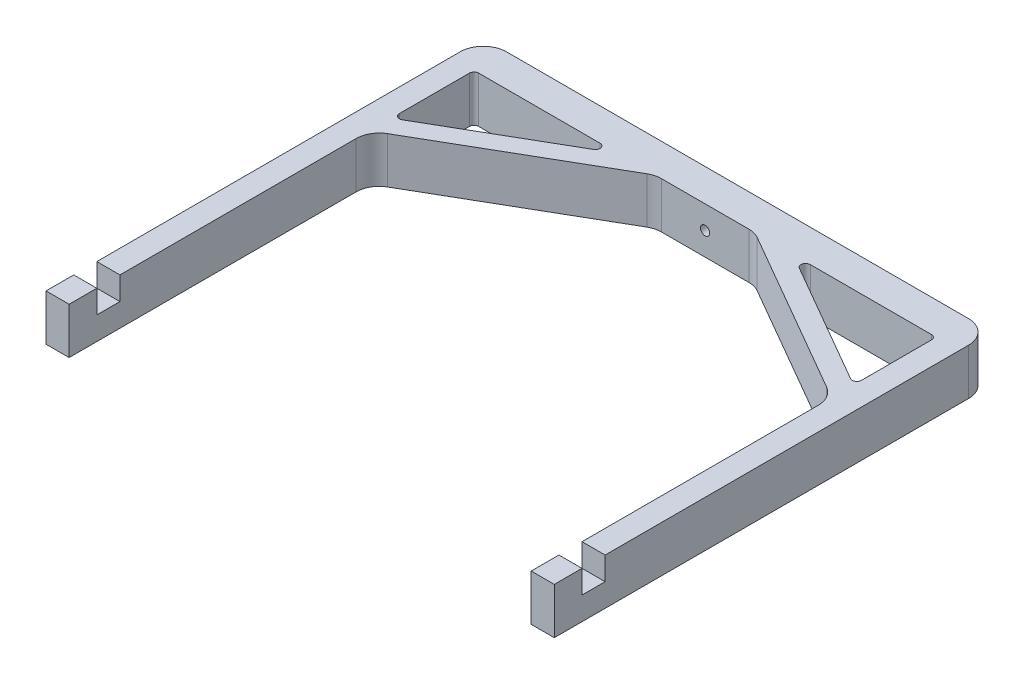
from build123d import *

# Parameters (mm, degrees)
DODANIE_WYCI_GNI_CIE1_DEPTH   = 10
SZKIC1_W                      = 5
SZKIC1_H                      = 6
DODANIE_WYCI_GNI_CIE1_2_DEPTH = 10
DODANIE_WYCI_GNI_CIE1_3_DEPTH = 10
SZKIC1_3_W                    = 5
SZKIC1_3_H                    = 5
DODANIE_WYCI_GNI_CIE2_DEPTH   = 5
SZKIC2_R                      = 1
WYTNIJ_WYCI_GNI_CIE1_DEPTH    = 104.949507791


with BuildPart() as part:
    # Szkic1 → Dodanie-wyciągnięcie1 (new body)
    with BuildSketch(Plane(origin=(0, 0, 0), x_dir=(1, 0, 0), z_dir=(0, 1, 0))):
        with BuildLine():
            Line((-9.449286184, 87.638462845), (9.449286184, 87.638462845))
            ThreePointArc((9.449286184, 87.638462845), (10.74338141, 87.468091977), (11.949286184, 86.968589864))
            Line((11.949286184, 86.968589864), (47.5, 66.443375673))
            ThreePointArc((47.5, 66.443375673), (49.330127019, 64.613248654), (50, 62.113248654))
            Line((50, 62.113248654), (50, 11))
            Line((50, 11), (55, 11))
            Line((55, 11), (55, 89.638462845))
            ThreePointArc((55, 89.638462845), (53.535533906, 93.173996751), (50, 94.638462845))
            Line((50, 94.638462845), (-50, 94.638462845))
            ThreePointArc((-50, 94.638462845), (-53.535533906, 93.173996751), (-55, 89.638462845))
            Line((-55, 89.638462845), (-55, 11))
            Line((-55, 11), (-50, 11))
            Line((-50, 11), (-50, 62.113248654))
            ThreePointArc((-50, 62.113248654), (-49.330127019, 64.613248654), (-47.5, 66.443375673))
            Line((-47.5, 66.443375673), (-11.949286184, 86.968589864))
            ThreePointArc((-11.949286184, 86.968589864), (-10.74338141, 87.468091977), (-9.449286184, 87.638462845))
        make_face()
        with BuildLine():
            ThreePointArc((-48.5, 70.620674679), (-49.5, 70.620674679), (-50, 71.486700083))
            Line((-50, 71.486700083), (-50, 86.638462845))
            ThreePointArc((-50, 86.638462845), (-49.707106781, 87.345569627), (-49, 87.638462845))
            Line((-49, 87.638462845), (-22.756377072, 87.638462845))
            ThreePointArc((-22.756377072, 87.638462845), (-21.790451246, 86.89728189), (-22.256377072, 85.772437442))
            Line((-22.256377072, 85.772437442), (-48.5, 70.620674679))
        make_face(mode=Mode.SUBTRACT)
        with BuildLine():
            Line((48.5, 70.620674679), (22.256377072, 85.772437442))
            ThreePointArc((22.256377072, 85.772437442), (21.790451246, 86.89728189), (22.756377072, 87.638462845))
            Line((22.756377072, 87.638462845), (49, 87.638462845))
            ThreePointArc((49, 87.638462845), (49.707106781, 87.345569627), (50, 86.638462845))
            Line((50, 86.638462845), (50, 71.486700083))
            ThreePointArc((50, 71.486700083), (49.5, 70.620674679), (48.5, 70.620674679))
        make_face(mode=Mode.SUBTRACT)
    extrude(amount=DODANIE_WYCI_GNI_CIE1_DEPTH)



with BuildPart() as body_2:
    # Szkic1 → Dodanie-wyci_gni_cie1 2 (new body)
    with BuildSketch(Plane(origin=(0, 0, 0), x_dir=(1, 0, 0), z_dir=(0, 1, 0))):
        with Locations((52.5, 3)):
            Rectangle(SZKIC1_W, SZKIC1_H)
    extrude(amount=DODANIE_WYCI_GNI_CIE1_2_DEPTH)


with BuildPart() as body_3:
    # Szkic1 → Dodanie-wyci_gni_cie1 3 (new body)
    with BuildSketch(Plane(origin=(0, 0, 0), x_dir=(1, 0, 0), z_dir=(0, 1, 0))):
        with Locations((-52.5, 3)):
            Rectangle(SZKIC1_W, SZKIC1_H)
    extrude(amount=DODANIE_WYCI_GNI_CIE1_3_DEPTH)


with BuildPart() as part_1:
    add(part.part)

    add(body_2.part)  # Dodanie-wyciągnięcie2 merges body 2

    add(body_3.part)  # Dodanie-wyciągnięcie2 merges body 3
    # Szkic1<3> → Dodanie-wyciągnięcie2 (add)
    with BuildSketch(Plane(origin=(0, 0, 0), x_dir=(1, 0, 0), z_dir=(0, 1, 0))):
        with Locations((52.5, 8.5)):
            Rectangle(SZKIC1_3_W, SZKIC1_3_H)
        with Locations((-52.5, 8.5)):
            Rectangle(SZKIC1_3_W, SZKIC1_3_H)
    extrude(amount=DODANIE_WYCI_GNI_CIE2_DEPTH)

    # Szkic2 → Wytnij-wyciągnięcie1 (cut, through all)
    with BuildSketch(Plane.XY.offset(-87.638462845)):
        with Locations((0, 5)):
            Circle(SZKIC2_R)
    extrude(amount=-WYTNIJ_WYCI_GNI_CIE1_DEPTH, mode=Mode.SUBTRACT)


solid = part_1.part
